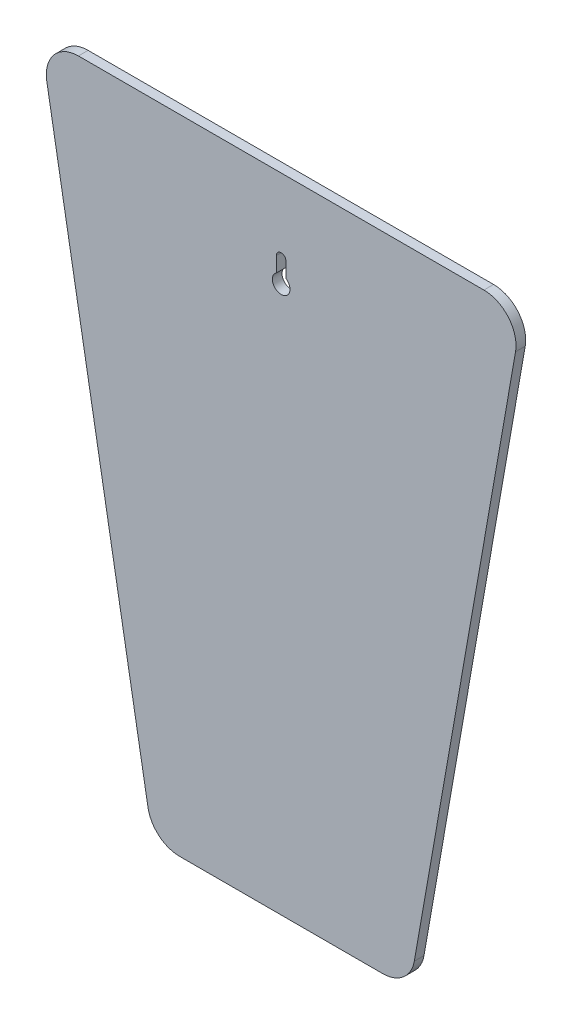
from build123d import *

# Parameters (mm, degrees)
BOSS_EXTRUDE1_DEPTH      = 3
BOSS_EXTRUDE1_DEPTH_BACK = 0.01
FILLET1_R                = 10
FILLET2_R                = 10
FILLET3_R                = 10
FILLET4_R                = 10
CUT_EXTRUDE8_DEPTH       = 10


with BuildPart() as part:
    # Sketch1 → Boss-Extrude1 (new, two sides: drawn at the far end of the back side and taken through both)
    with BuildSketch(Plane.XY.offset(-BOSS_EXTRUDE1_DEPTH_BACK)):
        Polygon((-40, 0), (40, 0), (75, 200), (-75, 200), align=None)
    extrude(amount=BOSS_EXTRUDE1_DEPTH + BOSS_EXTRUDE1_DEPTH_BACK)

    # Fillet1
    fillet1_edges = [part.edges().sort_by_distance(p)[0] for p in [
        (75, 200, 1.495),
    ]]
    fillet(fillet1_edges, radius=FILLET1_R)

    # Fillet2
    fillet2_edges = [part.edges().sort_by_distance(p)[0] for p in [
        (40, 0, 1.495),
    ]]
    fillet(fillet2_edges, radius=FILLET2_R)

    # Fillet3
    fillet3_edges = [part.edges().sort_by_distance(p)[0] for p in [
        (-40, 0, 1.495),
    ]]
    fillet(fillet3_edges, radius=FILLET3_R)

    # Fillet4
    fillet4_edges = [part.edges().sort_by_distance(p)[0] for p in [
        (-75, 200, 1.495),
    ]]
    fillet(fillet4_edges, radius=FILLET4_R)

    # Sketch4 → Cut-Extrude8 (cut)
    with BuildSketch(Plane.XY.offset(3)):
        with BuildLine():
            Line((-1.5, 177), (-1.5, 172.304886114))
            ThreePointArc((-1.5, 172.304886114), (0, 172.75), (1.5, 172.304886114))
            Line((1.5, 172.304886114), (1.5, 177))
            ThreePointArc((1.5, 177), (0, 178.5), (-1.5, 177))
        make_face()
        with BuildLine():
            ThreePointArc((1.5, 170), (0, 168.5), (-1.5, 170))
            Line((-1.5, 170), (-1.5, 172.304886114))
            ThreePointArc((-1.5, 172.304886114), (-1.31101106, 167.582615049), (2.75, 170))
            ThreePointArc((2.75, 170), (2.417384951, 171.31101106), (1.5, 172.304886114))
            Line((1.5, 172.304886114), (1.5, 170))
        make_face()
        with BuildLine():
            Line((-1.5, 172.304886114), (-1.5, 170))
            ThreePointArc((-1.5, 170), (0, 168.5), (1.5, 170))
            Line((1.5, 170), (1.5, 172.304886114))
            ThreePointArc((1.5, 172.304886114), (0, 172.75), (-1.5, 172.304886114))
        make_face()
    extrude(amount=-CUT_EXTRUDE8_DEPTH, mode=Mode.SUBTRACT)


solid = part.part
